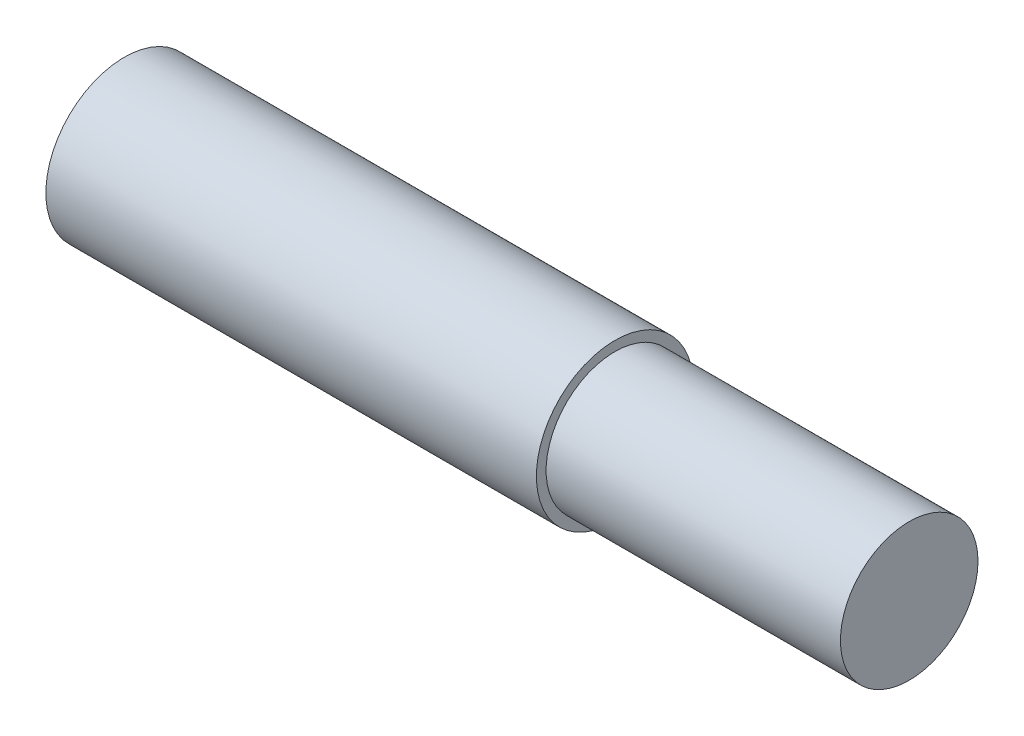
from build123d import *

# Parameters (mm, degrees)
SKETCH1_R           = 4
BOSS_EXTRUDE1_DEPTH = 25
SKETCH2_R           = 2.475
CUT_EXTRUDE1_DEPTH  = 15
SKETCH4_R           = 3.5052
BOSS_EXTRUDE2_DEPTH = 15


with BuildPart() as part:
    # Sketch1 → Boss-Extrude1 (new body)
    with BuildSketch(Plane(origin=(0, 0, 0), x_dir=(0, 0, -1), z_dir=(1, 0, 0))):
        Circle(SKETCH1_R)
    extrude(amount=BOSS_EXTRUDE1_DEPTH)

    # Sketch2 → Cut-Extrude1 (cut)
    with BuildSketch(Plane(origin=(0, 0, 0), x_dir=(0, 0, -1), z_dir=(1, 0, 0))):
        Circle(SKETCH2_R)
    extrude(amount=CUT_EXTRUDE1_DEPTH, mode=Mode.SUBTRACT)

    # Sketch4 → Boss-Extrude2 (add)
    with BuildSketch(Plane(origin=(25, 0, 0), x_dir=(0, 0, -1), z_dir=(1, 0, 0))):
        Circle(SKETCH4_R)
    extrude(amount=BOSS_EXTRUDE2_DEPTH)


solid = part.part
